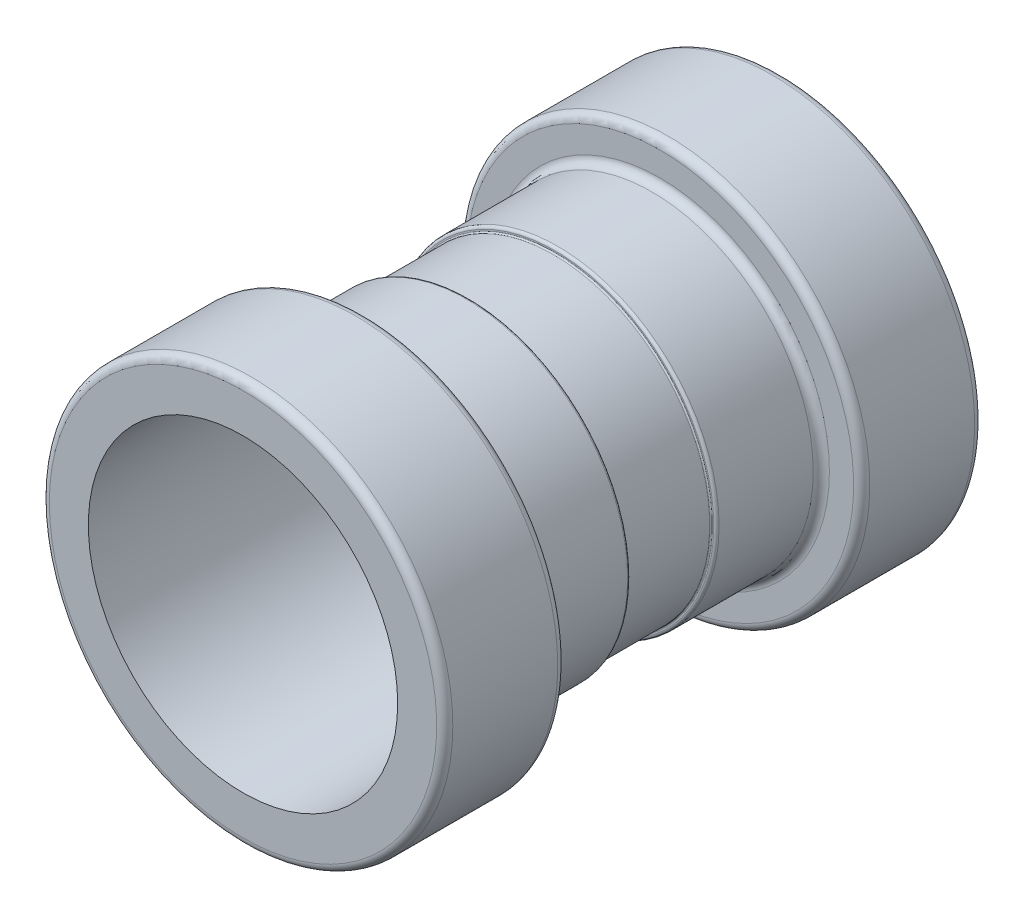
from build123d import *

# Parameters (mm, degrees)
IZIM2_R               = 57.5
KES_EKSTR_ZYON1_DEPTH = 227.384628487


with BuildPart() as part:
    # Çizim1 → Döndür3 (revolve)
    with BuildSketch(Plane(origin=(0, 0, 0), x_dir=(0, 0, -1), z_dir=(1, 0, 0)), mode=Mode.PRIVATE) as d_nd_r3_sk:
        with BuildLine():
            ThreePointArc((16, 58.5), (15.853553391, 58.146446609), (15.5, 58))
            Line((15.5, 58), (-15.5, 58))
            ThreePointArc((-15.5, 58), (-15.853553391, 58.146446609), (-16, 58.5))
            Line((-16, 58.5), (-16, 59))
            ThreePointArc((-16, 59), (-16.292893219, 59.707106781), (-17, 60))
            Line((-17, 60), (-52, 60))
            ThreePointArc((-52, 60), (-54.121320344, 60.878679656), (-55, 63))
            Line((-55, 63), (-55, 72))
            ThreePointArc((-55, 72), (-55.878679656, 74.121320344), (-58, 75))
            Line((-58, 75), (-97, 75))
            ThreePointArc((-97, 75), (-99.121320344, 74.121320344), (-100, 72))
            Line((-100, 72), (-100, 0))
            Line((-100, 0), (100, 0))
            Line((100, 0), (100, 72))
            ThreePointArc((100, 72), (99.121320344, 74.121320344), (97, 75))
            Line((97, 75), (58, 75))
            ThreePointArc((58, 75), (55.878679656, 74.121320344), (55, 72))
            Line((55, 72), (55, 63))
            ThreePointArc((55, 63), (54.121320344, 60.878679656), (52, 60))
            Line((52, 60), (17, 60))
            ThreePointArc((17, 60), (16.292893219, 59.707106781), (16, 59))
            Line((16, 59), (16, 58.5))
        make_face()
    revolve(d_nd_r3_sk.sketch.rotate(Axis((0, 0, 0), (0, 0, 1)), 90), axis=Axis((0, 0, 0), (0, 0, 1)))

    # Çizim2 → Kes-Ekstrüzyon1 (cut, through all)
    with BuildSketch(Plane.XY.offset(100)):
        Circle(IZIM2_R)
    extrude(amount=-KES_EKSTR_ZYON1_DEPTH, mode=Mode.SUBTRACT)


solid = part.part
